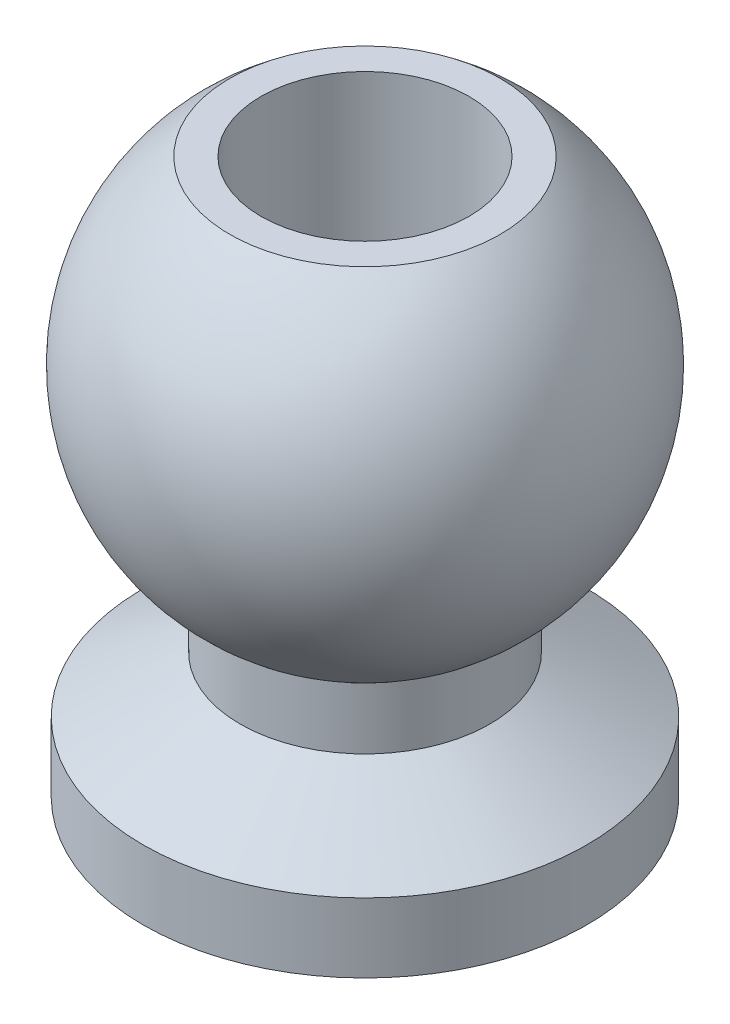
from build123d import *

# Parameters (mm, degrees)
SKETCH2_R               = 1.5
CUT_EXTRUDE1_DEPTH      = 10
CUT_EXTRUDE2_DEPTH      = 10
CUT_EXTRUDE2_DEPTH_BACK = 10
SKETCH3_W               = 11.471414326
SKETCH3_H               = 1.059782784


with BuildPart() as part:
    # Sketch1 → Revolve1 (revolve)
    with BuildSketch(Plane(origin=(0, 0, 0), x_dir=(0, 0, -1), z_dir=(1, 0, 0))):
        with BuildLine():
            Line((0, 8.65), (0, 0))
            Line((0, 0), (3.2, 0))
            Line((3.2, 0), (3.2, 1))
            Line((3.2, 1), (1.8, 1.808290377))
            Line((1.8, 1.808290377), (1.8, 2.693988174))
            ThreePointArc((1.8, 2.693988174), (3.111031857, 6.340202523), (0, 8.65))
        make_face()
    revolve(axis=Axis((0, 8.65, 0), (0, -1, 0)))

    # Sketch2 → Cut-Extrude1 (cut)
    with BuildSketch(Plane.XZ):
        Circle(SKETCH2_R)
    extrude(amount=-CUT_EXTRUDE1_DEPTH, mode=Mode.SUBTRACT)

    # Sketch3 → Cut-Extrude2 (cut, two sides: drawn at the far end of the back side and taken through both)
    with BuildSketch(Plane(origin=(0, 0, 0), x_dir=(0, 0, -1), z_dir=(1, 0, 0)).offset(-CUT_EXTRUDE2_DEPTH_BACK)):
        with Locations((2.521032719, 8.529891392)):
            Rectangle(SKETCH3_W, SKETCH3_H)
    extrude(amount=CUT_EXTRUDE2_DEPTH + CUT_EXTRUDE2_DEPTH_BACK, mode=Mode.SUBTRACT)


solid = part.part
